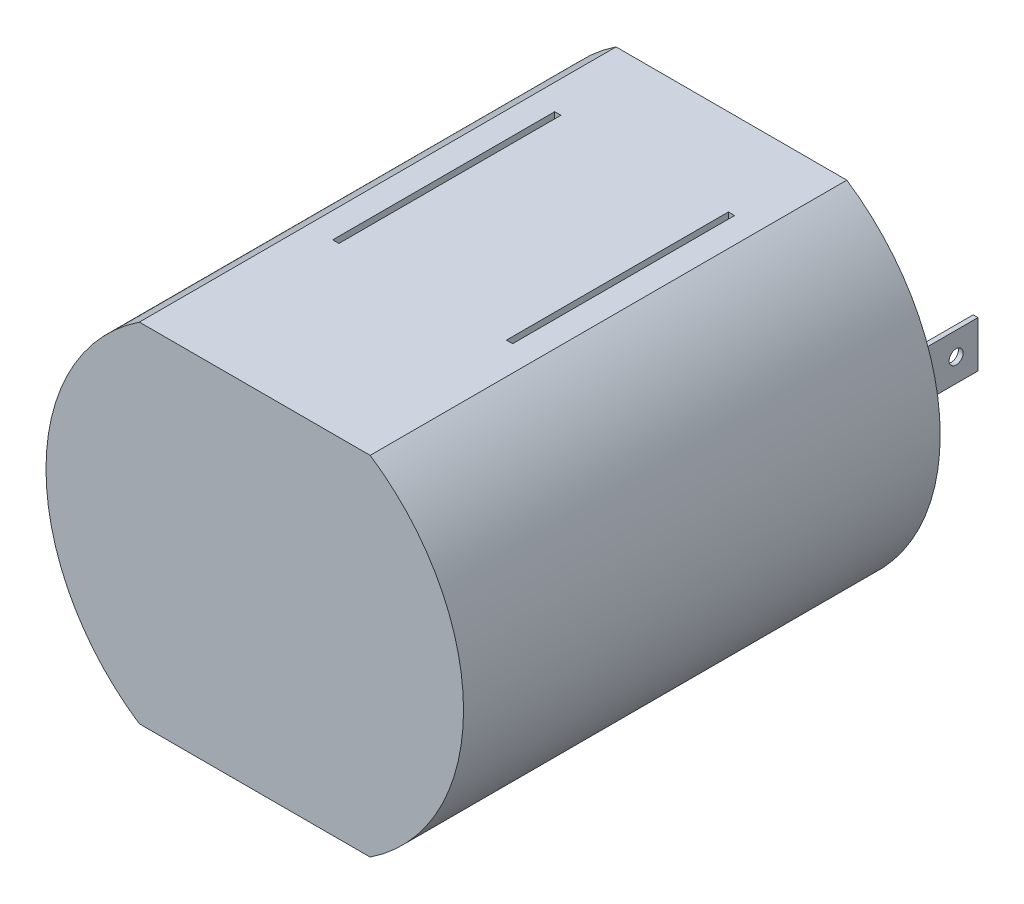
from build123d import *

# Parameters (mm, degrees)
BOSS_EXTRUDE1_DEPTH = 13.7
SKETCH3_W           = 0.178571672
SKETCH3_H           = 6.380917094
CUT_EXTRUDE1_DEPTH  = 0.2
SKETCH4_R           = 0.85
BOSS_EXTRUDE3_DEPTH = 1.8
SKETCH5_W           = 0.138137893
SKETCH5_H           = 1.329179466
BOSS_EXTRUDE4_DEPTH = 2.8
SKETCH6_R           = 0.20198457
CUT_EXTRUDE2_DEPTH  = 9.6


with BuildPart() as part:
    # Sketch1 → Boss-Extrude1 (new body)
    with BuildSketch(Plane.XY):
        with BuildLine():
            Line((-3.31662479, -5), (3.31662479, -5))
            ThreePointArc((3.31662479, -5), (6, 0), (3.31662479, 5))
            Line((3.31662479, 5), (-3.31662479, 5))
            ThreePointArc((-3.31662479, 5), (-6, 0), (-3.31662479, -5))
        make_face()
    extrude(amount=BOSS_EXTRUDE1_DEPTH)

    # Sketch3 → Cut-Extrude1 (cut)
    with BuildSketch(Plane(origin=(0, 5, 0), x_dir=(1, 0, 0), z_dir=(0, 1, 0))):
        with Locations((-2.495957535, -5.684471075)):
            Rectangle(SKETCH3_W, SKETCH3_H)
        with Locations((2.495957535, -5.684471075)):
            Rectangle(SKETCH3_W, SKETCH3_H)
    extrude(amount=-CUT_EXTRUDE1_DEPTH, mode=Mode.SUBTRACT)

    # Sketch4 → Boss-Extrude3 (add)
    with BuildSketch(Plane(origin=(0, 0, 0), x_dir=(-1, 0, 0), z_dir=(0, 0, -1))):
        with Locations(Location((0, 0, 0), (0, 0, 180))):
            Circle(SKETCH4_R)
    extrude(amount=BOSS_EXTRUDE3_DEPTH)

    # Sketch5 → Boss-Extrude4 (add)
    with BuildSketch(Plane(origin=(0, 0, 0), x_dir=(-1, 0, 0), z_dir=(0, 0, -1))):
        with Locations((-4.217525365, 0)):
            Rectangle(SKETCH5_W, SKETCH5_H)
        with Locations((4.217525365, 0)):
            Rectangle(SKETCH5_W, SKETCH5_H)
    extrude(amount=BOSS_EXTRUDE4_DEPTH)

    # Sketch6 → Cut-Extrude2 (cut)
    with BuildSketch(Plane.ZY.offset(4.286594311)):
        with Locations((-2.171650698, 0)):
            Circle(SKETCH6_R)
    extrude(amount=-CUT_EXTRUDE2_DEPTH, mode=Mode.SUBTRACT)


solid = part.part
